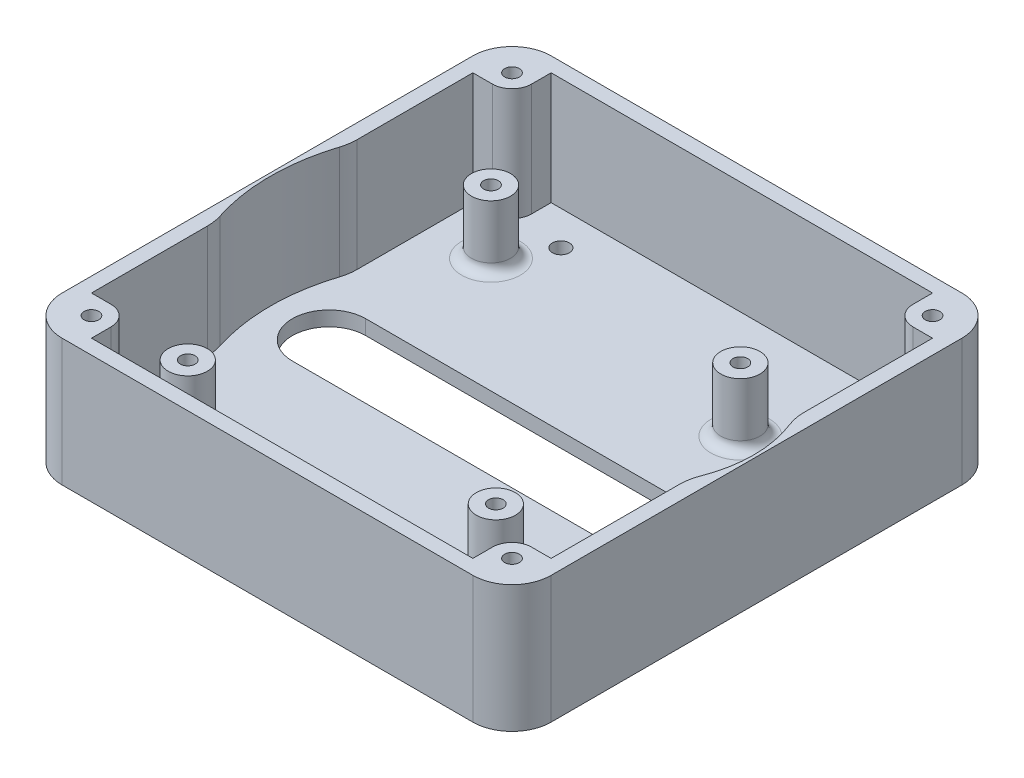
from build123d import *

# Parameters (mm, degrees)
SKETCH_1_W          = 100
SKETCH_1_H          = 100
SKETCH_1_R          = 1.5
EXTRUDE_1_DEPTH     = 3
SKETCH_4_W          = 100
SKETCH_4_H          = 100
EXTRUDE_4_DEPTH     = 23
SKETCH_5_R          = 4
SKETCH_5_R_2        = 1.5
EXTRUDE_5_DEPTH     = 13
FILLET_2_R          = 2
FILLET_3_R          = 8
SKETCH_7_R          = 1.5
EXTRUDE_6_DEPTH     = 23
SKETCH_8_R          = 1.75
SKETCH_8_R_2        = 2
CUT_EXTRUDE_2_DEPTH = 3


with BuildPart() as part:
    # Эскиз1 → Бобышка-Вытянуть1 (new body)
    with BuildSketch(Plane(origin=(0, 0, 0), x_dir=(1, 0, 0), z_dir=(0, 1, 0))):
        with Locations((50, 50)):
            Rectangle(SKETCH_1_W, SKETCH_1_H)
        with Locations(Location((14.7, 81, 0), (0, 0, 270))):
            Circle(SKETCH_1_R, mode=Mode.SUBTRACT)
        with Locations(Location((71.7, 75, 0), (0, 0, 270))):
            Circle(SKETCH_1_R, mode=Mode.SUBTRACT)
        with Locations(Location((71.7, 25, 0), (0, 0, 90))):
            Circle(SKETCH_1_R, mode=Mode.SUBTRACT)
        with Locations(Location((14.7, 19, 0), (0, 0, 90))):
            Circle(SKETCH_1_R, mode=Mode.SUBTRACT)
        with Locations(Location((7, 93, 0), (0, 0, 270))):
            Circle(SKETCH_1_R, mode=Mode.SUBTRACT)
        with Locations(Location((93, 93, 0), (0, 0, 90))):
            Circle(SKETCH_1_R, mode=Mode.SUBTRACT)
        with Locations(Location((93, 7, 0), (0, 0, 270))):
            Circle(SKETCH_1_R, mode=Mode.SUBTRACT)
        with Locations(Location((7, 7, 0), (0, 0, 90))):
            Circle(SKETCH_1_R, mode=Mode.SUBTRACT)
    extrude(amount=EXTRUDE_1_DEPTH)

    # Эскиз4 → Бобышка-Вытянуть4 (add)
    with BuildSketch(Plane(origin=(0, 3, 0), x_dir=(1, 0, 0), z_dir=(0, 1, 0))):
        with Locations((50, 50)):
            Rectangle(SKETCH_4_W, SKETCH_4_H)
        with BuildLine():
            Line((97, 97), (3, 97))
            Line((3, 97), (3, 65.304901176))
            ThreePointArc((3, 65.304901176), (2.879271228, 63.755707837), (2.52, 62.243920941))
            ThreePointArc((2.52, 62.243920941), (0.6, 50), (2.52, 37.756079059))
            ThreePointArc((2.52, 37.756079059), (2.879271228, 36.244292163), (3, 34.695098824))
            Line((3, 34.695098824), (3, 3))
            Line((3, 3), (97, 3))
            Line((97, 3), (97, 37.262653338))
            ThreePointArc((97, 37.262653338), (97.172923702, 39.114293537), (97.685714286, 40.901895241))
            ThreePointArc((97.685714286, 40.901895241), (99.4, 50), (97.685714286, 59.098104759))
            ThreePointArc((97.685714286, 59.098104759), (97.172923702, 60.885706463), (97, 62.737346662))
            Line((97, 62.737346662), (97, 97))
        make_face(mode=Mode.SUBTRACT)
    extrude(amount=EXTRUDE_4_DEPTH)

    # Эскиз5 → Бобышка-Вытянуть5 (add)
    # profile 1 of 4: a face of its own
    with BuildSketch(Plane(origin=(0, 3, 0), x_dir=(1, 0, 0), z_dir=(0, 1, 0))):
        with Locations(Location((14.7, 81, 0), (0, 0, 90))):
            Circle(SKETCH_5_R)
        with Locations(Location((14.7, 81, 0), (0, 0, 270))):
            Circle(SKETCH_5_R_2, mode=Mode.SUBTRACT)
    # profile 2 of 4: a face of its own
    with BuildSketch(Plane(origin=(0, 3, 0), x_dir=(1, 0, 0), z_dir=(0, 1, 0))):
        with Locations(Location((71.7, 75, 0), (0, 0, 90))):
            Circle(SKETCH_5_R)
        with Locations(Location((71.7, 75, 0), (0, 0, 270))):
            Circle(SKETCH_5_R_2, mode=Mode.SUBTRACT)
    # profile 3 of 4: a face of its own
    with BuildSketch(Plane(origin=(0, 3, 0), x_dir=(1, 0, 0), z_dir=(0, 1, 0))):
        with Locations(Location((71.7, 25, 0), (0, 0, 90))):
            Circle(SKETCH_5_R)
        with Locations(Location((71.7, 25, 0), (0, 0, 90))):
            Circle(SKETCH_5_R_2, mode=Mode.SUBTRACT)
    # profile 4 of 4: a face of its own
    with BuildSketch(Plane(origin=(0, 3, 0), x_dir=(1, 0, 0), z_dir=(0, 1, 0))):
        with Locations(Location((14.7, 19, 0), (0, 0, 90))):
            Circle(SKETCH_5_R)
        with Locations(Location((14.7, 19, 0), (0, 0, 90))):
            Circle(SKETCH_5_R_2, mode=Mode.SUBTRACT)
    extrude(amount=EXTRUDE_5_DEPTH)

    # Скругление2
    fillet_2_edges = [part.edges().sort_by_distance(p)[0] for p in [
        (71.7, 3, -21),
        (14.7, 3, -15),
        (14.7, 3, -77),
        (71.7, 3, -71),
    ]]
    fillet(fillet_2_edges, radius=FILLET_2_R)

    # Скругление3
    fillet_3_edges = [part.edges().sort_by_distance(p)[0] for p in [
        (0, 13, -100),
        (100, 13, -100),
        (100, 13, 0),
        (0, 13, 0),
    ]]
    fillet(fillet_3_edges, radius=FILLET_3_R)

    # Эскиз7 → Бобышка-Вытянуть6 (add)
    # profile 1 of 4: a face of its own
    with BuildSketch(Plane(origin=(0, 3, 0), x_dir=(1, 0, 0), z_dir=(0, 1, 0))):
        with BuildLine():
            Line((3, 89), (3, 97))
            Line((3, 97), (11, 97))
            Line((11, 97), (11, 93))
            ThreePointArc((11, 93), (9.828427125, 90.171572875), (7, 89))
            Line((7, 89), (3, 89))
        make_face()
        with Locations(Location((7, 93, 0), (0, 0, 270))):
            Circle(SKETCH_7_R, mode=Mode.SUBTRACT)
    # profile 2 of 4: a face of its own
    with BuildSketch(Plane(origin=(0, 3, 0), x_dir=(1, 0, 0), z_dir=(0, 1, 0))):
        with BuildLine():
            Line((89, 93), (89, 97))
            Line((89, 97), (97, 97))
            Line((97, 97), (97, 89))
            Line((97, 89), (93, 89))
            ThreePointArc((93, 89), (90.171572875, 90.171572875), (89, 93))
        make_face()
        with Locations(Location((93, 93, 0), (0, 0, 90))):
            Circle(SKETCH_7_R, mode=Mode.SUBTRACT)
    # profile 3 of 4: a face of its own
    with BuildSketch(Plane(origin=(0, 3, 0), x_dir=(1, 0, 0), z_dir=(0, 1, 0))):
        with BuildLine():
            Line((97, 11), (97, 3))
            Line((97, 3), (89, 3))
            Line((89, 3), (89, 7))
            ThreePointArc((89, 7), (90.171572875, 9.828427125), (93, 11))
            Line((93, 11), (97, 11))
        make_face()
        with Locations(Location((93, 7, 0), (0, 0, 270))):
            Circle(SKETCH_7_R, mode=Mode.SUBTRACT)
    # profile 4 of 4: a face of its own
    with BuildSketch(Plane(origin=(0, 3, 0), x_dir=(1, 0, 0), z_dir=(0, 1, 0))):
        with BuildLine():
            Line((11, 7), (11, 3))
            Line((11, 3), (3, 3))
            Line((3, 3), (3, 11))
            Line((3, 11), (7, 11))
            ThreePointArc((7, 11), (9.828427125, 9.828427125), (11, 7))
        make_face()
        with Locations(Location((7, 7, 0), (0, 0, 90))):
            Circle(SKETCH_7_R, mode=Mode.SUBTRACT)
    extrude(amount=EXTRUDE_6_DEPTH)

    # Эскиз8 → Вырез-Вытянуть2 (cut)
    with BuildSketch(Plane(origin=(0, 3, 0), x_dir=(1, 0, 0), z_dir=(0, 1, 0))):
        with Locations(Location((20, 90, 0), (0, 0, 270))):
            Circle(SKETCH_8_R)
        with Locations(Location((80, 90, 0), (0, 0, 90))):
            Circle(SKETCH_8_R)
        with Locations(Location((80, 10, 0), (0, 0, 270))):
            Circle(SKETCH_8_R)
        with Locations(Location((20, 10, 0), (0, 0, 90))):
            Circle(SKETCH_8_R)
        with Locations(Location((89.900400778, 61.508405751, 0), (0, 0, 270))):
            Circle(SKETCH_8_R_2)
        with Locations(Location((80, 61.508405751, 0), (0, 0, 270))):
            Circle(SKETCH_8_R_2)
        with BuildLine():
            Line((12.592071992, 57.5), (87.592071992, 57.5))
            ThreePointArc((87.592071992, 57.5), (95.092071992, 50), (87.592071992, 42.5))
            Line((87.592071992, 42.5), (12.592071992, 42.5))
            ThreePointArc((12.592071992, 42.5), (5.092071992, 50), (12.592071992, 57.5))
        make_face()
    extrude(amount=-CUT_EXTRUDE_2_DEPTH, mode=Mode.SUBTRACT)


solid = part.part
